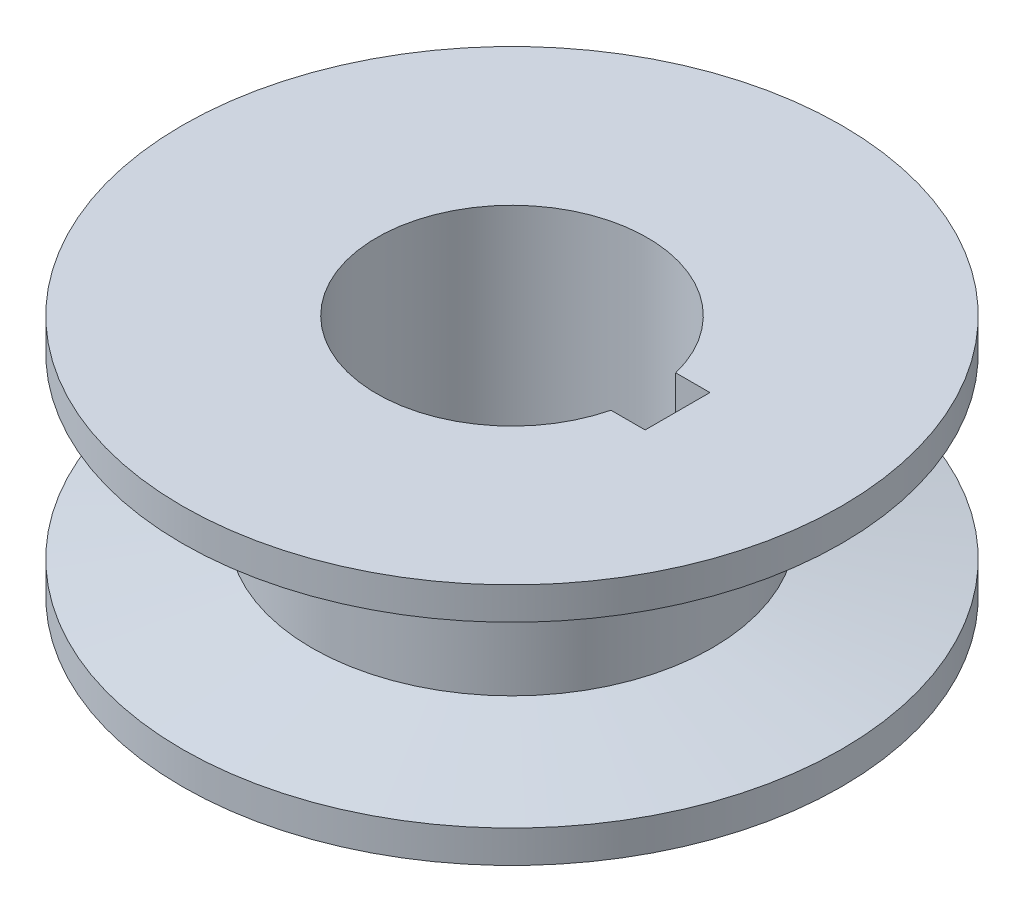
from build123d import *

# Parameters (mm, degrees)
SKETCH2_W          = 10.216941
SKETCH2_H          = 4
CUT_EXTRUDE1_DEPTH = 15


with BuildPart() as part:
    # Sketch1 → Revolve1 (revolve)
    with BuildSketch(Plane.XY):
        Polygon((20.35, 5.5), (12.35, 4.089384154), (12.35, -4.089384154), (20.35, -5.5), (20.35, -7.5), (8.35, -7.5), (8.35, 7.5), (20.35, 7.5), align=None)
    revolve(axis=Axis((0, -1000, 0), (0, 1, 0)))

    # Sketch2 → Cut-Extrude1 (cut)
    with BuildSketch(Plane(origin=(0, 7.5, 0), x_dir=(1, 0, 0), z_dir=(0, 1, 0))):
        with Locations((5.1084705, 0)):
            Rectangle(SKETCH2_W, SKETCH2_H)
    extrude(amount=-CUT_EXTRUDE1_DEPTH, mode=Mode.SUBTRACT)


solid = part.part
